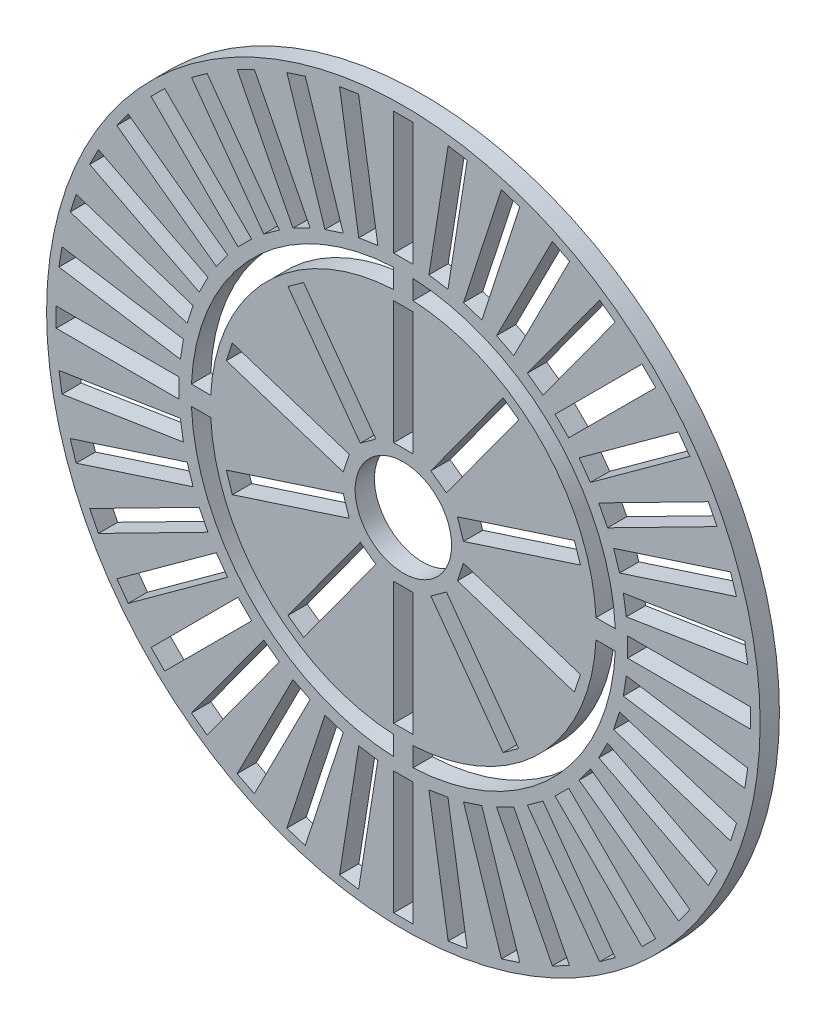
from build123d import *

# Parameters (mm, degrees)
SKETCH1_R          = 37
SKETCH1_R_2        = 5
BASE_DEPTH         = 1
SKETCH2_W          = 2
SKETCH2_H          = 12.75
YTRE_RING_DEPTH    = 2
CIRPATTERN1_COUNT  = 40
SKETCH3_W          = 2
SKETCH3_H          = 12.75
CUT_EXTRUDE2_DEPTH = 2
CIRPATTERN2_COUNT  = 10


with BuildPart() as part:
    # Sketch1 → Base (new, symmetric)
    with BuildSketch(Plane.XY):
        Circle(SKETCH1_R)
        Circle(SKETCH1_R_2, mode=Mode.SUBTRACT)
        with BuildLine():
            Line((1, 21.977260976), (1, 19.974984355))
            ThreePointArc((1, 19.974984355), (14.142135624, 14.142135624), (19.974984355, 1))
            Line((19.974984355, 1), (21.977260976, 1))
            ThreePointArc((21.977260976, 1), (15.556349186, 15.556349186), (1, 21.977260976))
        make_face(mode=Mode.SUBTRACT)
        with BuildLine():
            Line((-1, 21.977260976), (-1, 19.974984355))
            ThreePointArc((-1, 19.974984355), (-14.142135624, 14.142135624), (-19.974984355, 1))
            Line((-19.974984355, 1), (-21.977260976, 1))
            ThreePointArc((-21.977260976, 1), (-15.556349186, 15.556349186), (-1, 21.977260976))
        make_face(mode=Mode.SUBTRACT)
        with BuildLine():
            Line((21.977260976, -1), (19.974984355, -1))
            ThreePointArc((19.974984355, -1), (14.142135624, -14.142135624), (1, -19.974984355))
            Line((1, -19.974984355), (1, -21.977260976))
            ThreePointArc((1, -21.977260976), (15.556349186, -15.556349186), (21.977260976, -1))
        make_face(mode=Mode.SUBTRACT)
        with BuildLine():
            Line((-1, -21.977260976), (-1, -19.974984355))
            ThreePointArc((-1, -19.974984355), (-14.142135624, -14.142135624), (-19.974984355, -1))
            Line((-19.974984355, -1), (-21.977260976, -1))
            ThreePointArc((-21.977260976, -1), (-15.556349186, -15.556349186), (-1, -21.977260976))
        make_face(mode=Mode.SUBTRACT)
    extrude(amount=BASE_DEPTH, both=True)

    # Sketch2 → Ytre ring (cut)
    with BuildSketch(Plane.XY.offset(1)):
        with Locations((0, 29.625)):
            Rectangle(SKETCH2_W, SKETCH2_H)
    ytre_ring = extrude(amount=-YTRE_RING_DEPTH, mode=Mode.SUBTRACT)

    # CirPattern1: Ytre ring ×40 about axis
    cirpattern1_axis = Axis((0, 0, 0), (0, 0, 1))
    for i in range(1, CIRPATTERN1_COUNT):
        add(ytre_ring.rotate(cirpattern1_axis, i * 360 / CIRPATTERN1_COUNT), mode=Mode.SUBTRACT)

    # Sketch3 → Cut-Extrude2 (cut)
    with BuildSketch(Plane.XY.offset(1)):
        with Locations((0, 12.599984355)):
            Rectangle(SKETCH3_W, SKETCH3_H)
    cut_extrude2 = extrude(amount=-CUT_EXTRUDE2_DEPTH, mode=Mode.SUBTRACT)

    # CirPattern2: Cut-Extrude2 ×10 about axis
    cirpattern2_axis = Axis((0, 0, 0), (0, 0, 1))
    for i in range(1, CIRPATTERN2_COUNT):
        add(cut_extrude2.rotate(cirpattern2_axis, i * 360 / CIRPATTERN2_COUNT), mode=Mode.SUBTRACT)


solid = part.part
